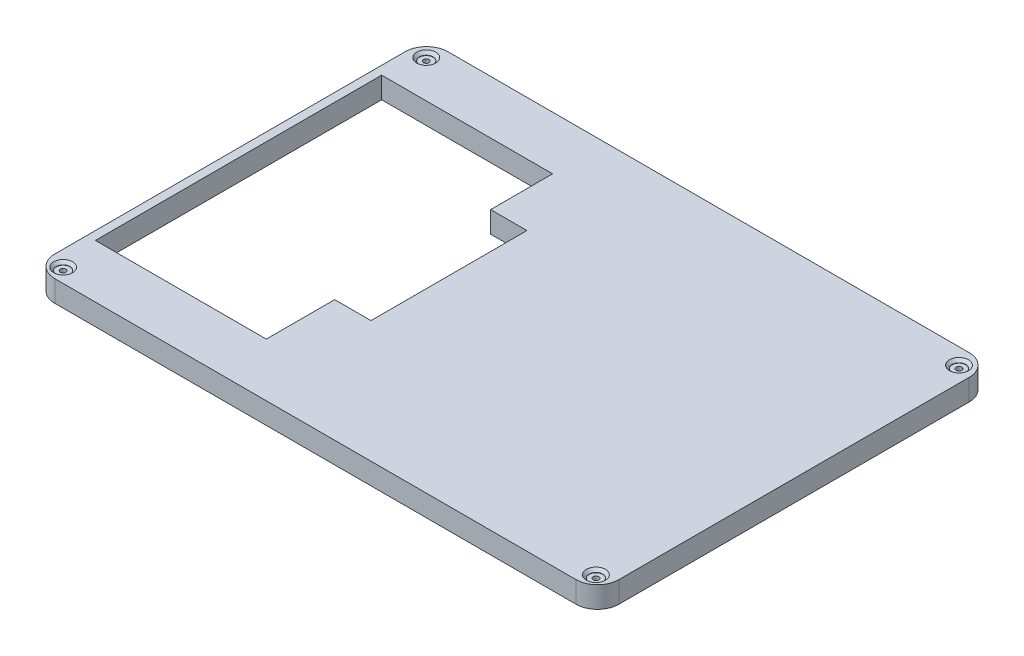
from build123d import *

# Parameters (mm, degrees)
BOSS_EXTRUDE1_DEPTH                         = 5
CBORE_FOR_00_BINDING_HEAD_MACHINE_S_2_COUNT = 2
CBORE_FOR_00_BINDING_HEAD_MACHINE_S_2_PITCH = 124.680760017
CBORE_FOR_00_BINDING_HEAD_MACHINE_S_3_COUNT = 2
CBORE_FOR_00_BINDING_HEAD_MACHINE_S_3_PITCH = 84.969496715
CBORE_FOR_00_BINDING_HEAD_MACHINE_S_4_COUNT = 2
CBORE_FOR_00_BINDING_HEAD_MACHINE_S_4_PITCH = 150.881103158


with BuildPart() as part:
    # Sketch2 → Boss-Extrude1 (new body)
    with BuildSketch(Plane(origin=(0, 0, 0), x_dir=(1, 0, 0), z_dir=(0, 1, 0))):
        with BuildLine():
            Line((-61, -46), (61, -46))
            ThreePointArc((61, -46), (64.535533906, -44.535533906), (66, -41))
            Line((66, -41), (66, 41))
            ThreePointArc((66, 41), (64.535533906, 44.535533906), (61, 46))
            Line((61, 46), (-61, 46))
            ThreePointArc((-61, 46), (-64.535533906, 44.535533906), (-66, 41))
            Line((-66, 41), (-66, -41))
            ThreePointArc((-66, -41), (-64.535533906, -44.535533906), (-61, -46))
        make_face()
        Polygon((-64, -33.5), (-24, -33.5), (-24, -17.5), (-15.5, -17.5), (-15.5, 19), (-24, 19), (-24, 33.5), (-64, 33.5), align=None, mode=Mode.SUBTRACT)
    extrude(amount=BOSS_EXTRUDE1_DEPTH)

    # Sketch5 → CBORE for #00 Binding Head Machine Screw1 (revolve, cut)
    with BuildSketch(Plane(origin=(-62.340407583, 5, -42.268283337), x_dir=(0, 0, 1), z_dir=(1, 0, 0))):
        Polygon((0, 0), (0, 5.396808353), (0.6604, 5), (0.6604, 0.7112), (1.5875, 0.7112), (1.5875, 0.635), (2.2225, 0), align=None)
    cbore_for_00_binding_head_machine_screw = revolve(axis=Axis((-62.340407583, 11.35, -42.268283337), (0, -1, 0)), mode=Mode.SUBTRACT)

    # CBORE for _00 Binding Head Machine S 2: CBORE for #00 Binding Head Machine Screw1 ×2
    with Locations(*[(i * CBORE_FOR_00_BINDING_HEAD_MACHINE_S_2_PITCH, 0, 0) for i in range(1, CBORE_FOR_00_BINDING_HEAD_MACHINE_S_2_COUNT)]):
        add(cbore_for_00_binding_head_machine_screw, mode=Mode.SUBTRACT)

    # CBORE for _00 Binding Head Machine S 3: CBORE for #00 Binding Head Machine Screw1 ×2
    with Locations(*[(0, 0, i * CBORE_FOR_00_BINDING_HEAD_MACHINE_S_3_PITCH) for i in range(1, CBORE_FOR_00_BINDING_HEAD_MACHINE_S_3_COUNT)]):
        add(cbore_for_00_binding_head_machine_screw, mode=Mode.SUBTRACT)

    # CBORE for _00 Binding Head Machine S 4: CBORE for #00 Binding Head Machine Screw1 ×2
    with Locations(*[Vector(0.8263510632316995, 0, 0.563155325195314) * (i * CBORE_FOR_00_BINDING_HEAD_MACHINE_S_4_PITCH) for i in range(1, CBORE_FOR_00_BINDING_HEAD_MACHINE_S_4_COUNT)]):
        add(cbore_for_00_binding_head_machine_screw, mode=Mode.SUBTRACT)


solid = part.part
